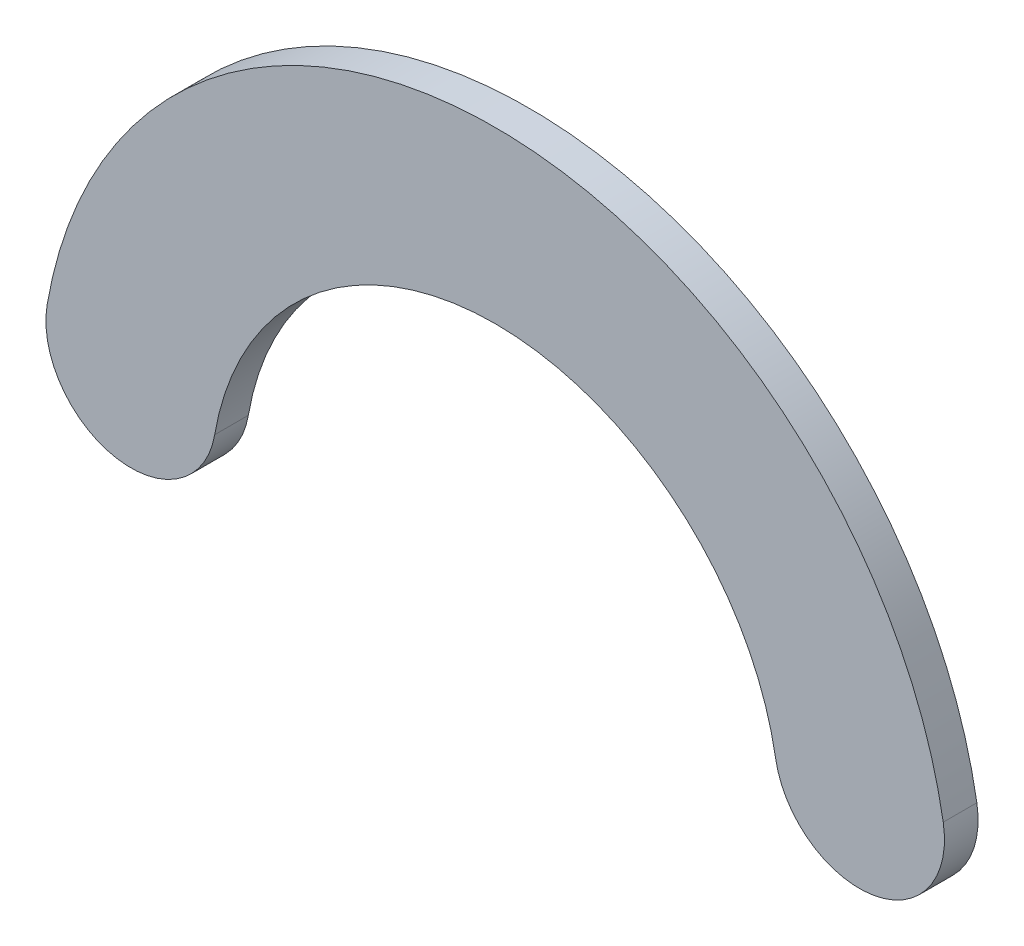
from build123d import *

# Parameters (mm, degrees)
BOSS_EXTRUDE1_DEPTH = 5
CUT_EXTRUDE1_DEPTH  = 3.5


with BuildPart() as part:
    # Sketch1 → Boss-Extrude1 (new body)
    with BuildSketch(Plane.XY):
        with BuildLine():
            ThreePointArc((83.37845056, 14.469012335), (16.768892688, 70.623970918), (-49.840665185, 14.469012335))
            ThreePointArc((-49.840665185, 14.469012335), (-39.521894243, -0.123659797), (-24.929222112, 10.195111145))
            ThreePointArc((-24.929222112, 10.195111145), (16.768892688, 45.348563357), (58.467007487, 10.195111145))
            ThreePointArc((58.467007487, 10.195111145), (73.059679618, -0.123659797), (83.37845056, 14.469012335))
        make_face()
    extrude(amount=BOSS_EXTRUDE1_DEPTH)

    # Sketch2 → Cut-Extrude1 (cut)
    with BuildSketch(Plane(origin=(0, 0, 0), x_dir=(-1, 0, 0), z_dir=(0, 0, -1))):
        with BuildLine():
            ThreePointArc((46.94943865, 13.837591132), (-16.768892688, 68.310693084), (-80.487224025, 13.837591132))
            ThreePointArc((-80.487224025, 13.837591132), (-72.428258415, 2.767566738), (-61.358234021, 10.826532348))
            ThreePointArc((-61.358234021, 10.826532348), (-16.768892688, 48.946170535), (27.820448646, 10.826532348))
            ThreePointArc((27.820448646, 10.826532348), (38.89047304, 2.767566738), (46.94943865, 13.837591132))
        make_face()
    extrude(amount=-CUT_EXTRUDE1_DEPTH, mode=Mode.SUBTRACT)


solid = part.part
